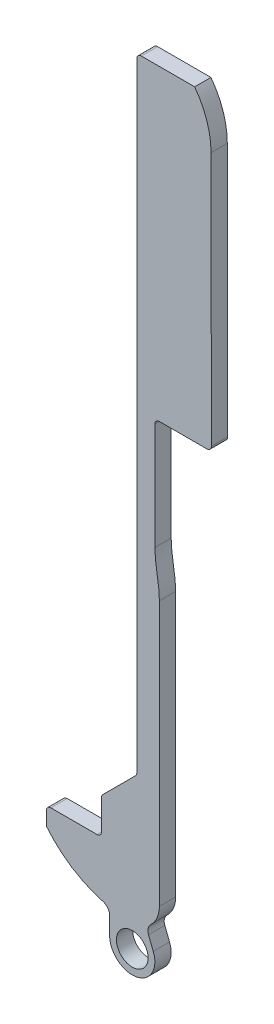
from build123d import *

# Parameters (mm, degrees)
BOSS_EXTRUDE1_DEPTH = 1.8
FILLET1_R           = 0.5
SKETCH5_R           = 2.5
SKETCH5_R_2         = 1.75
BOSS_EXTRUDE2_DEPTH = 1.8
FILLET2_R           = 1


with BuildPart() as part:
    # Sketch1 → Boss-Extrude1 (new body)
    with BuildSketch(Plane.XY):
        with BuildLine():
            Line((0, 4.5), (0, 6.5))
            Line((0, 6.5), (6.1, 6.5))
            Line((6.1, 6.5), (6.1, 10.5))
            Line((6.1, 10.5), (10, 14.4))
            Line((10, 14.4), (10, 83.5))
            Line((10, 83.5), (16.4, 83.5))
            ThreePointArc((16.4, 83.5), (17.745328581, 80.945017946), (18.212299295, 78.095495067))
            Line((18.212299295, 78.095495067), (18.25, 49.5))
            Line((18.25, 49.5), (12, 49.5))
            Line((12, 49.5), (12, 37.18))
            add(Edge.make_bspline(
                [(12, 37.18), (12, 35.554764974), (12.5, 33.972282338), (12.5, 32.33)],
                knots=[0, 0, 0, 0, 1, 1, 1, 1], degree=3))
            Line((12.5, 32.33), (12.5, 3.07))
            ThreePointArc((12.5, 3.07), (11.600817818, 0.899182182), (9.43, 0))
            ThreePointArc((9.43, 0), (4.205660329, 1.182650422), (0, 4.5))
        make_face()
    extrude(amount=BOSS_EXTRUDE1_DEPTH)

    # Fillet1
    fillet1_edges = [part.edges().sort_by_distance(p)[0] for p in [
        (0, 6.5, 0.9),
        (6.1, 6.5, 0.9),
        (6.1, 10.5, 0.9),
        (10, 14.4, 0.9),
        (10, 83.5, 0.9),
        (18.25, 49.5, 0.9),
        (12, 49.5, 0.9),
    ]]
    fillet(fillet1_edges, radius=FILLET1_R)

    # Sketch5 → Boss-Extrude2 (add)
    # profile 1 of 3: a face of its own
    with BuildSketch(Plane(origin=(0, 0, 0), x_dir=(-1, 0, 0), z_dir=(0, 0, -1))):
        with Locations((-9.5, -2.499832541)):
            Circle(SKETCH5_R)
        with Locations((-9.5, -2.499832541)):
            Circle(SKETCH5_R_2, mode=Mode.SUBTRACT)
    # profile 2 of 3: a face of its own
    with BuildSketch(Plane(origin=(0, 0, 0), x_dir=(-1, 0, 0), z_dir=(0, 0, -1))):
        with BuildLine():
            ThreePointArc((-11.824045318, -1.578521867), (-9.031018815, -0.044215175), (-7, -2.499832541))
            Line((-7, -2.499832541), (-7, 0.245881701))
            ThreePointArc((-7, 0.245881701), (-8.2087959, 0.061626967), (-9.43, 0))
            ThreePointArc((-9.43, 0), (-10.256451345, 0.113333266), (-11.021883517, 0.444965358))
            Line((-11.021883517, 0.444965358), (-11.824045318, -1.578521867))
        make_face()
    # profile 3 of 3: a face of its own
    with BuildSketch(Plane(origin=(0, 0, 0), x_dir=(-1, 0, 0), z_dir=(0, 0, -1))):
        with BuildLine():
            ThreePointArc((-9.43, 0), (-8.2087959, 0.061626967), (-7, 0.245881701))
            Line((-7, 0.245881701), (-7, 0.500167459))
            Line((-7, 0.500167459), (-11, 0.500167459))
            Line((-11, 0.500167459), (-11.021883517, 0.444965358))
            ThreePointArc((-11.021883517, 0.444965358), (-10.256451345, 0.113333266), (-9.43, 0))
        make_face()
    extrude(amount=-BOSS_EXTRUDE2_DEPTH)

    # Fillet2
    fillet2_edges = [part.edges().sort_by_distance(p)[0] for p in [
        (7, 0.245881701, 0.9),
        (11.021883517, 0.444965358, 0.9),
    ]]
    fillet(fillet2_edges, radius=FILLET2_R)


solid = part.part
